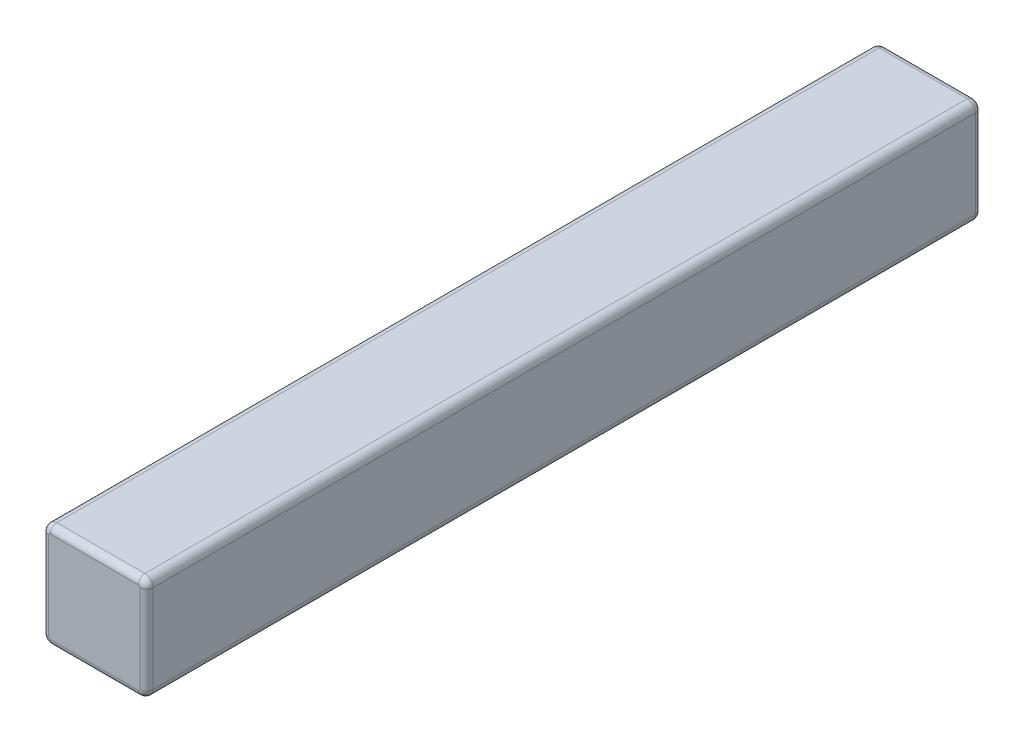
from build123d import *

# Parameters (mm, degrees)
BOSS_EXTRUDE1_DEPTH = 25.4
FILLET1_R           = 0.2


with BuildPart() as part:
    # Sketch1 → Boss-Extrude1 (new body)
    with BuildSketch(Plane.XY):
        with BuildLine():
            Line((-1.3375, 1.5875), (1.3375, 1.5875))
            ThreePointArc((1.3375, 1.5875), (1.514276695, 1.514276695), (1.5875, 1.3375))
            Line((1.5875, 1.3375), (1.5875, -1.3375))
            ThreePointArc((1.5875, -1.3375), (1.514276695, -1.514276695), (1.3375, -1.5875))
            Line((1.3375, -1.5875), (-1.3375, -1.5875))
            ThreePointArc((-1.3375, -1.5875), (-1.514276695, -1.514276695), (-1.5875, -1.3375))
            Line((-1.5875, -1.3375), (-1.5875, 1.3375))
            ThreePointArc((-1.5875, 1.3375), (-1.514276695, 1.514276695), (-1.3375, 1.5875))
        make_face()
    extrude(amount=BOSS_EXTRUDE1_DEPTH)

    # Fillet1
    fillet1_edges = [part.edges().sort_by_distance(p)[0] for p in [
        (-1.514276695, -1.514276695, 25.4),
        (-1.5875, 0, 0),
        (-1.514276695, 1.514276695, 0),
        (0, -1.5875, 25.4),
        (1.514276695, -1.514276695, 25.4),
        (1.5875, 0, 25.4),
        (1.514276695, 1.514276695, 25.4),
        (0, 1.5875, 25.4),
        (-1.514276695, 1.514276695, 25.4),
        (-1.5875, 0, 25.4),
        (0, 1.5875, 0),
        (1.514276695, 1.514276695, 0),
        (1.5875, 0, 0),
        (1.514276695, -1.514276695, 0),
        (0, -1.5875, 0),
        (-1.514276695, -1.514276695, 0),
    ]]
    fillet(fillet1_edges, radius=FILLET1_R)


solid = part.part
